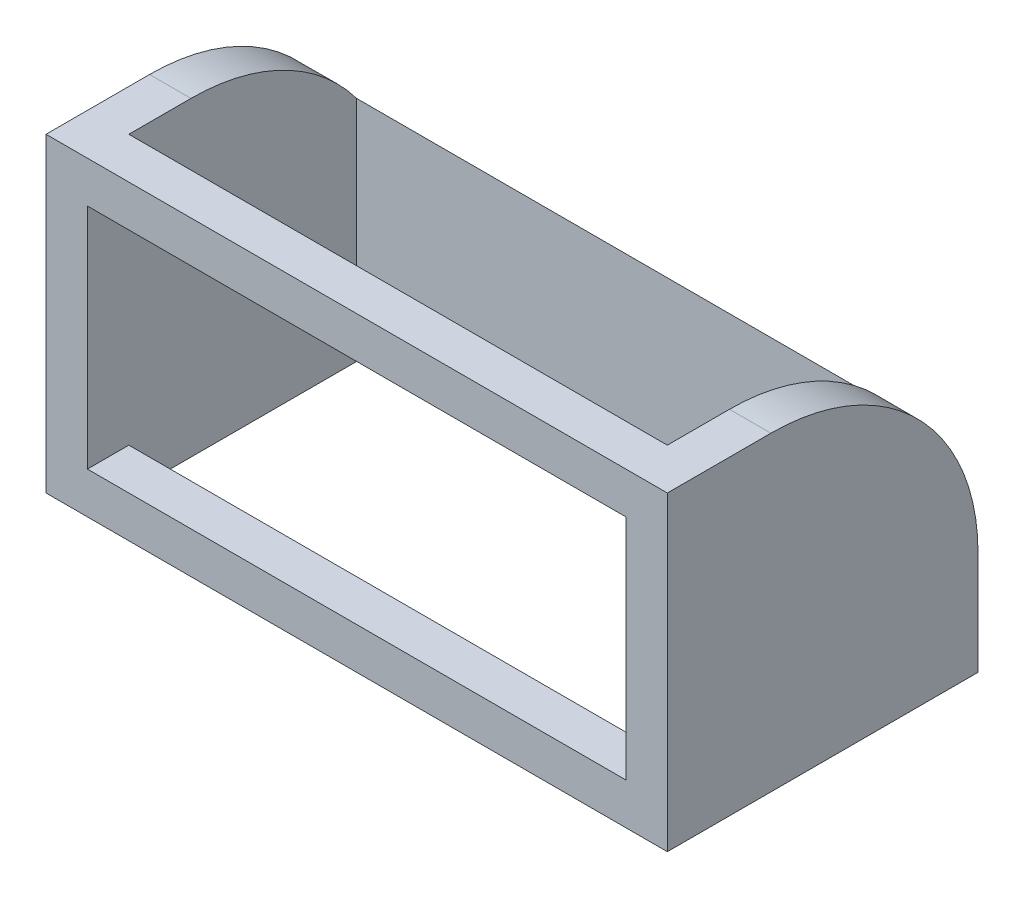
from build123d import *

# Parameters (mm, degrees)
SKETCH12_W              = 30
SKETCH12_H              = 15
BOSS_EXTRUDE4_DEPTH     = 15
FILLET1_R               = 10
CUT_EXTRUDE8_DEPTH      = 23.5
CUT_EXTRUDE8_DEPTH_BACK = 23.5
SKETCH13_W              = 26
SKETCH13_H              = 11
SKETCH14_W              = 26
SKETCH14_H              = 11
CUT_EXTRUDE9_DEPTH      = 10


with BuildPart() as part:
    # Sketch12 → Boss-Extrude4 (new body)
    with BuildSketch(Plane(origin=(0, 0, 0), x_dir=(1, 0, 0), z_dir=(0, 1, 0))):
        Rectangle(SKETCH12_W, SKETCH12_H)
    extrude(amount=BOSS_EXTRUDE4_DEPTH)

    # Fillet1
    fillet1_edges = [part.edges().sort_by_distance(p)[0] for p in [
        (0, 15, -7.5),
    ]]
    fillet(fillet1_edges, radius=FILLET1_R)

    # Sketch13 → Cut-Extrude8 (cut, two sides: drawn at the far end of the back side and taken through both)
    with BuildSketch(Plane.XZ.offset(-CUT_EXTRUDE8_DEPTH_BACK)):
        Rectangle(SKETCH13_W, SKETCH13_H)
    extrude(amount=CUT_EXTRUDE8_DEPTH + CUT_EXTRUDE8_DEPTH_BACK, mode=Mode.SUBTRACT)

    # Sketch14 → Cut-Extrude9 (cut)
    with BuildSketch(Plane.XY.offset(7.5)):
        with Locations((0, 7.5)):
            Rectangle(SKETCH14_W, SKETCH14_H)
    extrude(amount=-CUT_EXTRUDE9_DEPTH, mode=Mode.SUBTRACT)


solid = part.part
